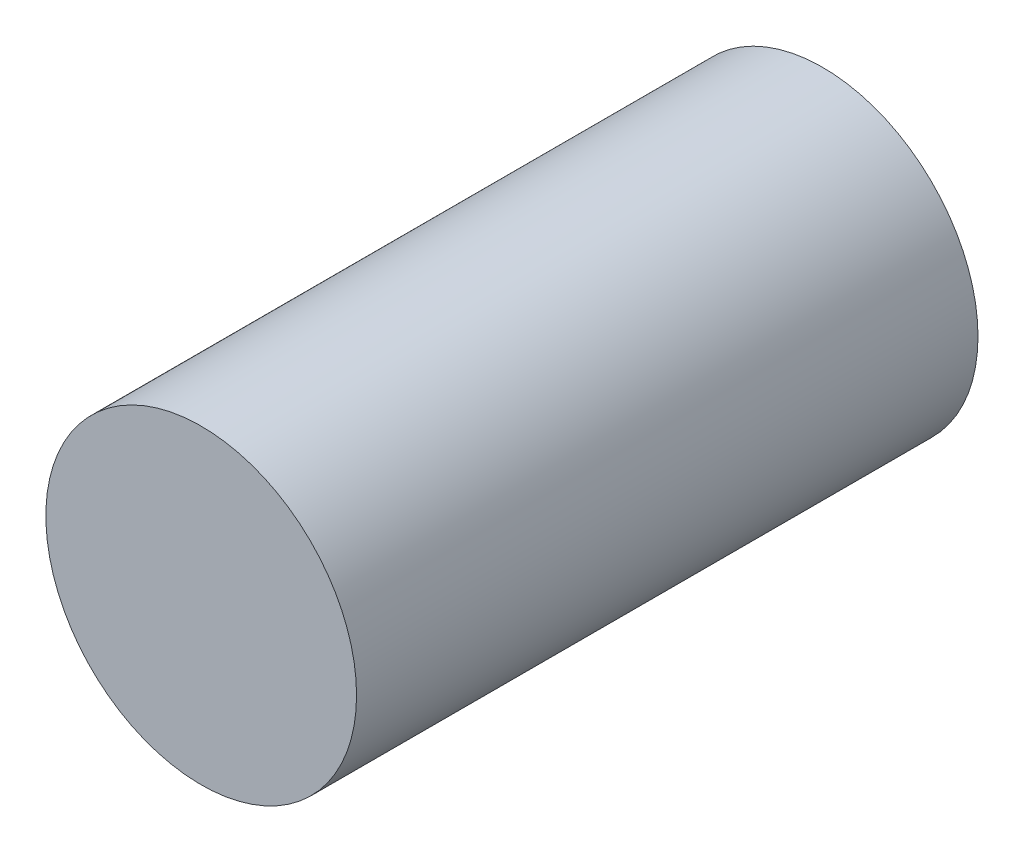
from build123d import *

# Parameters (mm, degrees)
ESBO_O1_R                = 1.5
RESSALTO_EXTRUS_O1_DEPTH = 6


with BuildPart() as part:
    # Esboço1 → Ressalto-extrusão1 (new body)
    with BuildSketch(Plane.XY):
        Circle(ESBO_O1_R)
    extrude(amount=RESSALTO_EXTRUS_O1_DEPTH)


solid = part.part
